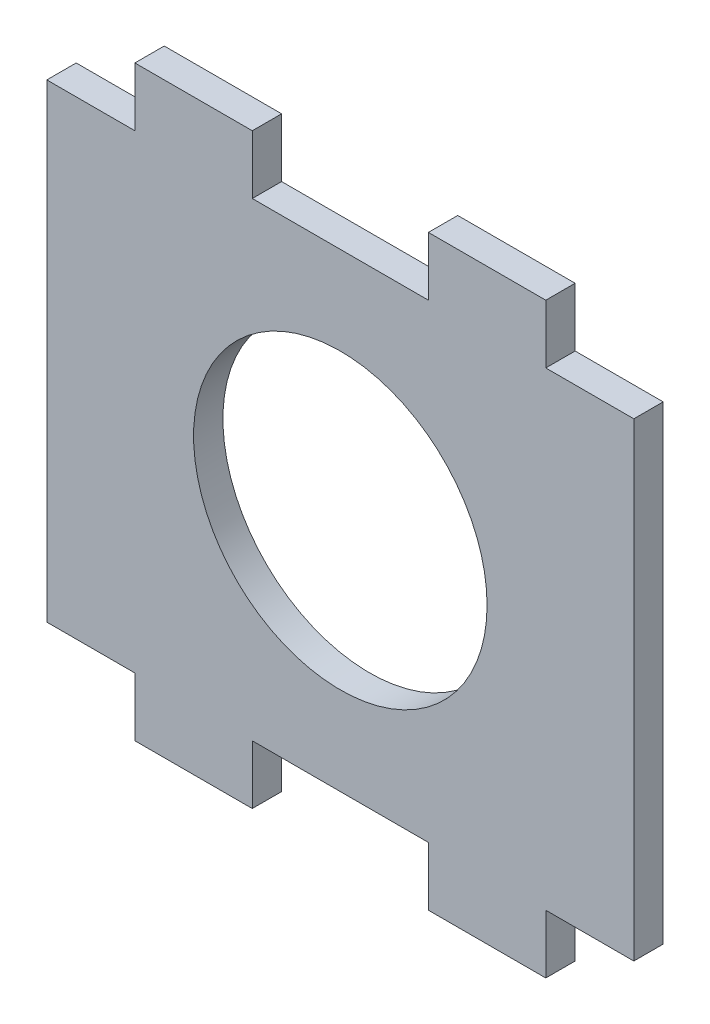
from build123d import *

# Parameters (mm, degrees)
SKETCH1_W           = 12.7
SKETCH1_H           = 6.35
SKETCH1_W_2         = 63.5
SKETCH1_H_2         = 50.8
SKETCH1_R           = 15.875
BOSS_EXTRUDE1_DEPTH = 3.175


with BuildPart() as part:
    # Sketch1 → Boss-Extrude1 (new body)
    # profile 1 of 5: a face of its own
    with BuildSketch(Plane.XY):
        with Locations((-15.875, 28.575)):
            Rectangle(SKETCH1_W, SKETCH1_H)
    # profile 2 of 5: a face of its own
    with BuildSketch(Plane.XY):
        Rectangle(SKETCH1_W_2, SKETCH1_H_2)
        Circle(SKETCH1_R, mode=Mode.SUBTRACT)
    # profile 3 of 5: a face of its own
    with BuildSketch(Plane.XY):
        with Locations((15.875, 28.575)):
            Rectangle(SKETCH1_W, SKETCH1_H)
    # profile 4 of 5: a face of its own
    with BuildSketch(Plane.XY):
        with Locations((15.875, -28.575)):
            Rectangle(SKETCH1_W, SKETCH1_H)
    # profile 5 of 5: a face of its own
    with BuildSketch(Plane.XY):
        with Locations((-15.875, -28.575)):
            Rectangle(SKETCH1_W, SKETCH1_H)
    extrude(amount=BOSS_EXTRUDE1_DEPTH)


solid = part.part
